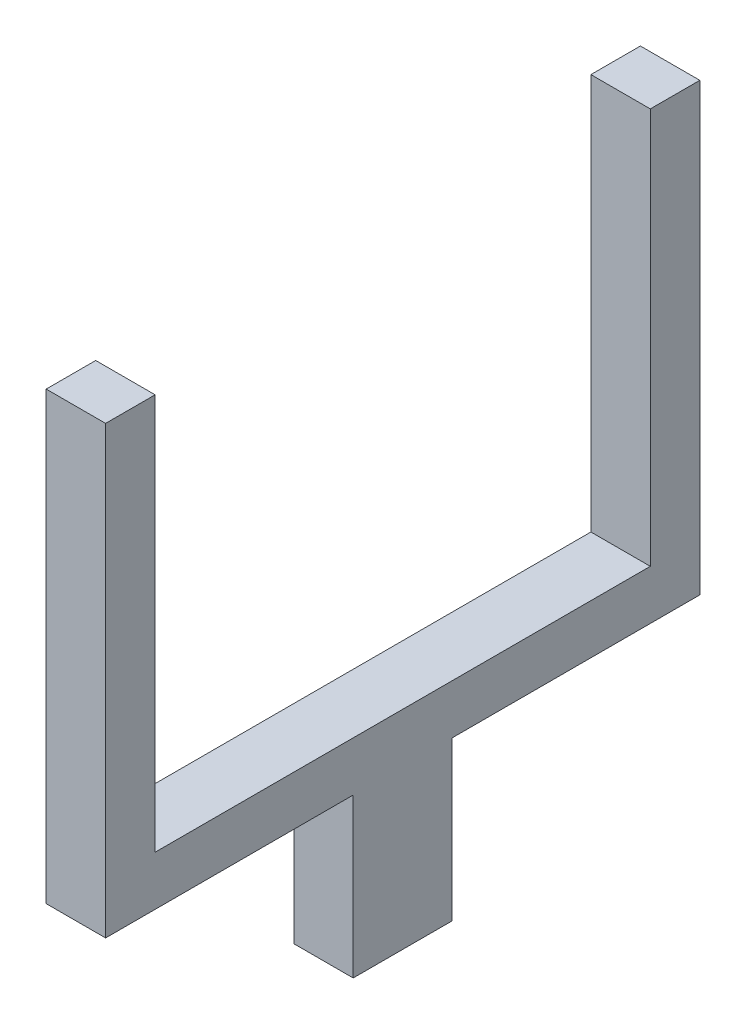
from build123d import *

# Parameters (mm, degrees)
BOSS_EXTRUDE1_DEPTH = 3


with BuildPart() as part:
    # Sketch1 → Boss-Extrude1 (new body)
    with BuildSketch(Plane(origin=(0, 0, 0), x_dir=(0, 0, -1), z_dir=(1, 0, 0))):
        Polygon((2.5, 0), (-2.5, 0), (-2.5, 8), (-15, 8), (-15, 30.5), (-12.5, 30.5), (-12.5, 10.5), (12.5, 10.5), (12.5, 30.5), (15, 30.5), (15, 8), (2.5, 8), align=None)
    extrude(amount=BOSS_EXTRUDE1_DEPTH)


solid = part.part
